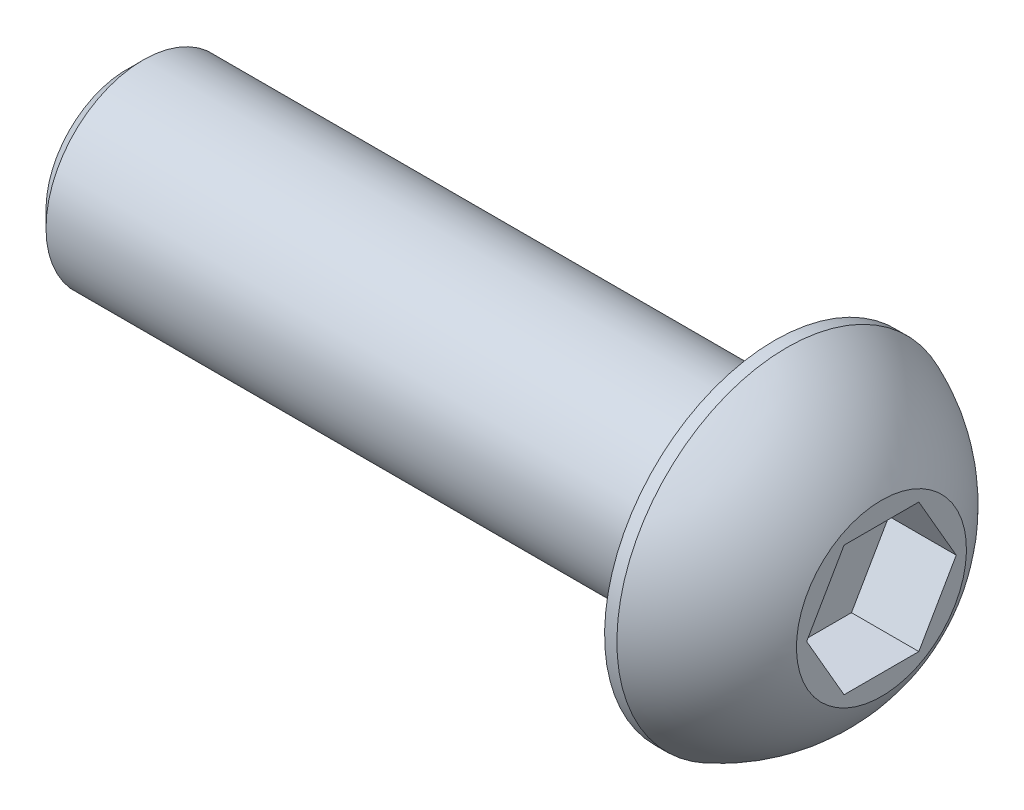
from build123d import *

# Parameters (mm, degrees)
CUT_EXTRUDE1_DEPTH = 2.08
CHAMFER1_SIZE      = 0.5


with BuildPart() as part:
    # Sketch1 → Revolve1 (revolve)
    with BuildSketch(Plane.XY):
        with BuildLine():
            Line((0, 0), (0, 2.625))
            ThreePointArc((0, 2.625), (-1.224500646, 4.199464996), (-2.92, 5.25))
            Line((-2.92, 5.25), (-3.3, 5.25))
            Line((-3.3, 5.25), (-3.3, 3))
            Line((-3.3, 3), (-23.3, 3))
            Line((-23.3, 3), (-23.3, 0))
            Line((-23.3, 0), (0, 0))
        make_face()
    revolve(axis=Axis((0, 0, 0), (-1, 0, 0)))

    # Sketch2 → Cut-Extrude1 (cut)
    with BuildSketch(Plane(origin=(0, 0, 0), x_dir=(0, 0, -1), z_dir=(1, 0, 0))):
        Polygon((2.309401077, 0), (1.154700538, 2), (-1.154700538, 2), (-2.309401077, 0), (-1.154700538, -2), (1.154700538, -2), align=None)
    extrude(amount=-CUT_EXTRUDE1_DEPTH, mode=Mode.SUBTRACT)

    # Chamfer1
    chamfer1_edges = [part.edges().sort_by_distance(p)[0] for p in [
        (-23.3, -3, 0),
    ]]
    chamfer(chamfer1_edges, length=CHAMFER1_SIZE)


solid = part.part
